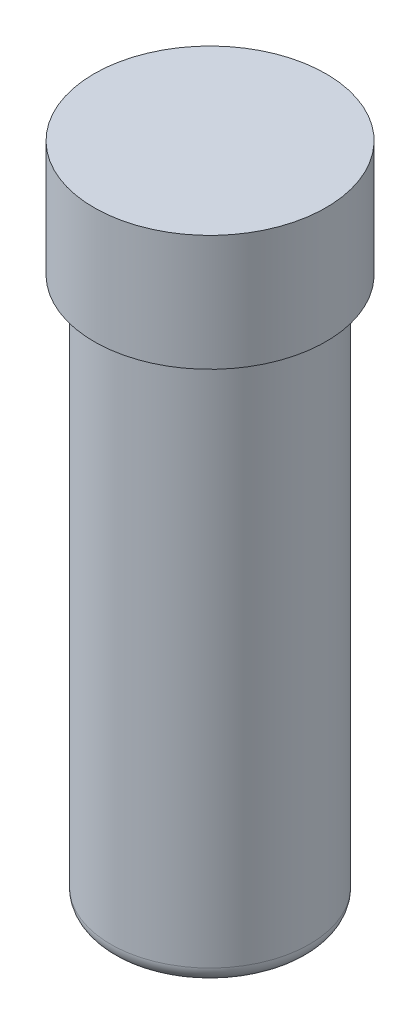
from build123d import *

# Parameters (mm, degrees)
FILLET1_R = 1


with BuildPart() as part:
    # Sketch1 → Revolve1 (revolve)
    with BuildSketch(Plane.XY, mode=Mode.PRIVATE) as revolve1_sk:
        Polygon((0, 0), (6, 0), (6, 33), (7, 33), (7, 40), (0, 40), align=None)
    revolve(revolve1_sk.sketch.rotate(Axis((0, 40, 0), (0, -1, 0)), 180), axis=Axis((0, 40, 0), (0, -1, 0)))

    # Fillet1
    fillet1_edges = [part.edges().sort_by_distance(p)[0] for p in [
        (6, 0, 0),
    ]]
    fillet(fillet1_edges, radius=FILLET1_R)


solid = part.part
